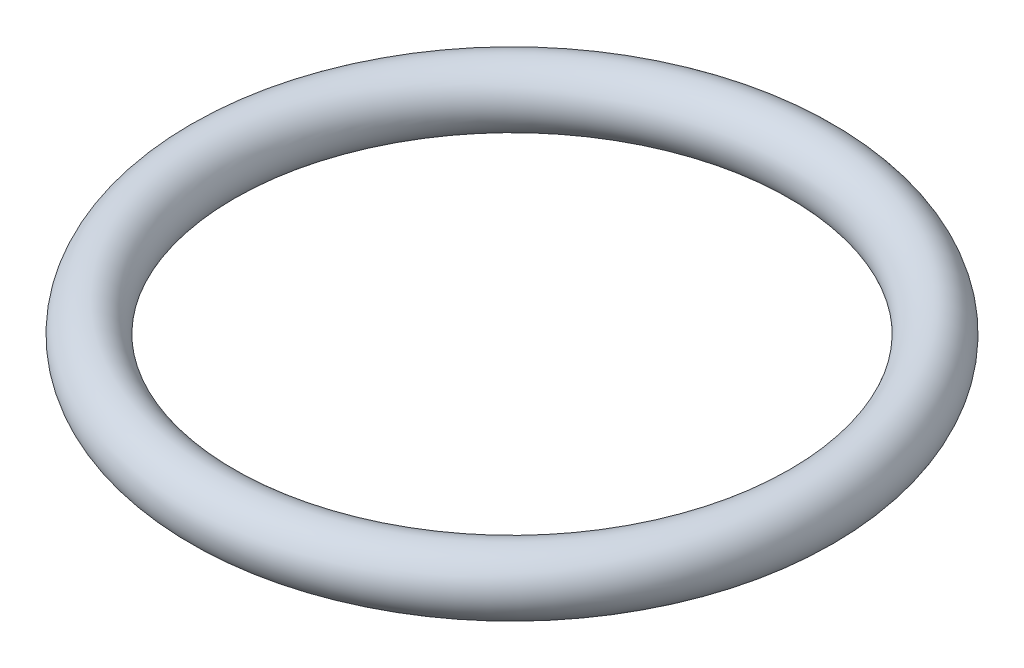
from build123d import *

# Parameters (mm, degrees)
ESBO_O2_R = 1.35


with BuildPart() as part:
    # Varredura1: sweep along a path in Esboço1
    with BuildLine(Plane(origin=(0, 0, 0), x_dir=(1, 0, 0), z_dir=(0, 1, 0))) as varredura1_path:
        CenterArc((0, 0), 13.3, 0, 360)
    # Esboço2 → Varredura1 (sweep)
    with BuildSketch(Plane.XY):
        with Locations((-13.295637672, 0)):
            Circle(ESBO_O2_R)
    sweep(path=varredura1_path.line)


solid = part.part
